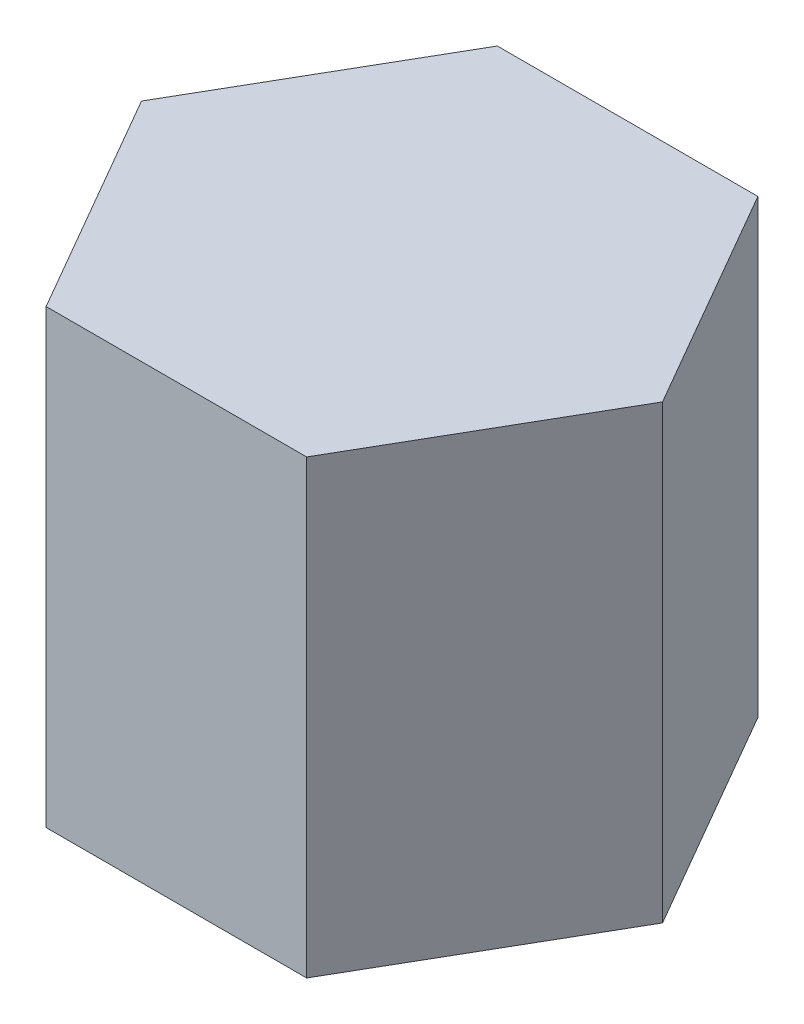
from build123d import *

# Parameters (mm, degrees)
EXTRUDE1_DEPTH = 100


with BuildPart() as part:
    # Sketch1 → Extrude1 (new body)
    with BuildSketch(Plane(origin=(0, 0, 0), x_dir=(1, 0, 0), z_dir=(0, 1, 0))):
        Polygon((-28.867513459, 50), (-57.735026919, 0), (-28.867513459, -50), (28.867513459, -50), (57.735026919, 0), (28.867513459, 50), align=None)
    extrude(amount=EXTRUDE1_DEPTH)


solid = part.part
